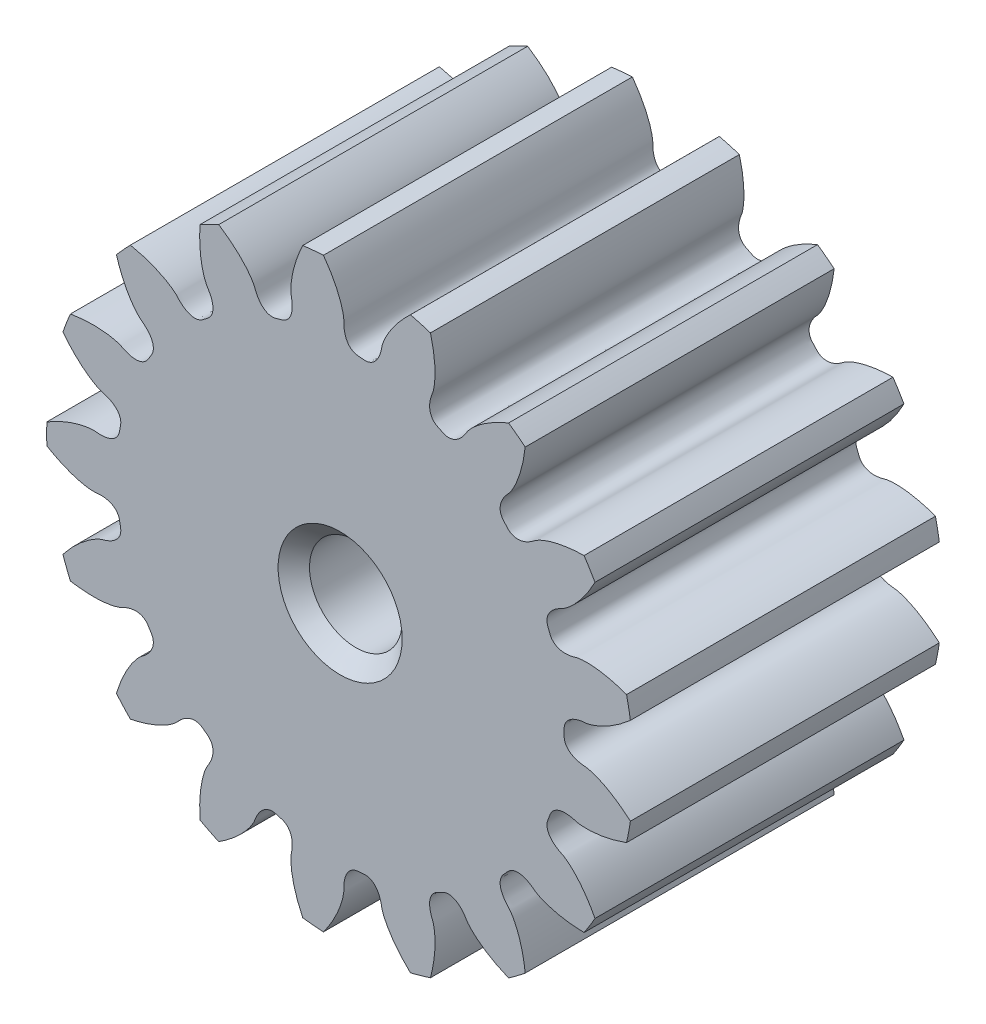
from build123d import *

# Parameters (mm, degrees)
SKETCHREVOLVESUN_DRIVER01_W       = 5
SKETCHREVOLVESUN_DRIVER01_H       = 4.749999929
TOOTHEXTRUDECUTSUN_DRIVER01_DEPTH = 2.5
PATTERNSUN_DRIVER01_COUNT         = 17


with BuildPart() as part:
    # SketchRevolveSun_Driver01 → Sun_Driver01 (revolve)
    with BuildSketch(Plane(origin=(0, 0, 0), x_dir=(0, 0, -1), z_dir=(1, 0, 0))):
        with Locations((0, 2.374999965)):
            Rectangle(SKETCHREVOLVESUN_DRIVER01_W, SKETCHREVOLVESUN_DRIVER01_H)
    revolve(axis=Axis((0, 0, 0), (0, 0, -1)))

    # SketchToothSun_Driver01 → ToothExtrudeCutSun_Driver01 (cut, symmetric)
    with BuildSketch(Plane.XY):
        with BuildLine():
            ThreePointArc((4.719414727, 0.726463315), (4.774999928, 0), (4.719414727, -0.726463315))
            add(Edge.make_bspline(
                [(4.719414727, -0.726463315), (4.679039269, -0.690122976), (4.618418671, -0.638866693), (4.536557963, -0.576450099), (4.478904146, -0.535404267), (4.423511436, -0.498639419), (4.370594611, -0.465960849), (4.320358036, -0.437164405), (4.272995281, -0.412037088), (4.228688763, -0.390357505), (4.187609407, -0.371896395), (4.149916338, -0.356417116), (4.115756563, -0.343676262), (4.085264771, -0.333423928), (4.05856286, -0.325405137), (4.035760373, -0.319357776), (4.016952383, -0.315020807), (4.002224556, -0.312113937), (3.96894373, -0.306699142), (3.931233385, -0.305550712), (3.889266542, -0.298153709), (3.863998971, -0.29282817), (3.839662239, -0.286456564), (3.816205108, -0.279076695), (3.793580644, -0.270597426), (3.771735091, -0.260917684), (3.750618038, -0.249881774), (3.730194534, -0.237274468), (3.710469538, -0.222805489), (3.69152856, -0.206103582), (3.673602238, -0.186729965), (3.657142778, -0.164237818), (3.64292129, -0.138300451), (3.631935308, -0.108943129), (3.626153194, -0.079410247), (3.623748976, -0.042794472), (3.625833653, 0), (3.623748976, 0.042794472), (3.626153194, 0.079410247), (3.631935308, 0.108943129), (3.64292129, 0.138300451), (3.657142778, 0.164237818), (3.673602238, 0.186729965), (3.69152856, 0.206103582), (3.710469538, 0.222805489), (3.730194534, 0.237274468), (3.750618038, 0.249881774), (3.771735091, 0.260917684), (3.793580644, 0.270597426), (3.816205108, 0.279076695), (3.839662239, 0.286456564), (3.863998971, 0.29282817), (3.889266542, 0.298153709), (3.931233385, 0.305550712), (3.96894373, 0.306699142), (4.002224556, 0.312113937), (4.016952383, 0.315020807), (4.035760373, 0.319357776), (4.05856286, 0.325405137), (4.085264771, 0.333423928), (4.115756563, 0.343676262), (4.149916338, 0.356417116), (4.187609407, 0.371896395), (4.228688763, 0.390357505), (4.272995281, 0.412037088), (4.320358036, 0.437164405), (4.370594611, 0.465960849), (4.423511436, 0.498639419), (4.478904146, 0.535404267), (4.536557963, 0.576450099), (4.618418671, 0.638866693), (4.679039269, 0.690122976), (4.719414727, 0.726463315)],
                knots=[0, 0, 0, 0, 0.058364616, 0.085243058, 0.110585589, 0.134392209, 0.156662918, 0.177397716, 0.196596603, 0.21425958, 0.230386645, 0.2449778, 0.258033043, 0.269552376, 0.279535798, 0.287983309, 0.29489491, 0.3002706, 0.304110379, 0.331113618, 0.34062545, 0.349862158, 0.358855237, 0.367643072, 0.376272627, 0.384801461, 0.393300011, 0.401853859, 0.410565316, 0.419552882, 0.42894596, 0.438870848, 0.449423906, 0.460632045, 0.472412501, 0.481614351, 0.5, 0.518385649, 0.527587499, 0.539367955, 0.550576094, 0.561129152, 0.57105404, 0.580447118, 0.589434684, 0.598146141, 0.606699989, 0.615198539, 0.623727373, 0.632356928, 0.641144763, 0.650137842, 0.65937455, 0.668886382, 0.695889621, 0.6997294, 0.70510509, 0.712016691, 0.720464202, 0.730447624, 0.741966957, 0.7550222, 0.769613355, 0.78574042, 0.803403397, 0.822602284, 0.843337082, 0.865607791, 0.889414411, 0.914756942, 0.941635384, 1, 1, 1, 1], degree=3))
        make_face()
    toothextrudecutsun_driver01 = extrude(amount=TOOTHEXTRUDECUTSUN_DRIVER01_DEPTH, both=True, mode=Mode.SUBTRACT)

    # PatternSun_Driver01: ToothExtrudeCutSun_Driver01 ×17 about axis
    patternsun_driver01_axis = Axis((0, 0, 50), (0, 0, -1))
    for i in range(1, PATTERNSUN_DRIVER01_COUNT):
        add(toothextrudecutsun_driver01.rotate(patternsun_driver01_axis, i * 360 / PATTERNSUN_DRIVER01_COUNT), mode=Mode.SUBTRACT)

    # BoreRevolveSketch → BoreRevolveCut (revolve, cut)
    with BuildSketch(Plane(origin=(0, 0, 0), x_dir=(0, 0, -1), z_dir=(1, 0, 0))):
        Polygon((-2.5, 0), (2.5, 0), (2.5, 1.003999996), (2.246000004, 0.75), (-2.246000004, 0.75), (-2.5, 1.003999996), align=None)
    revolve(axis=Axis((0, 0, 0), (0, 0, -1)), mode=Mode.SUBTRACT)


solid = part.part
